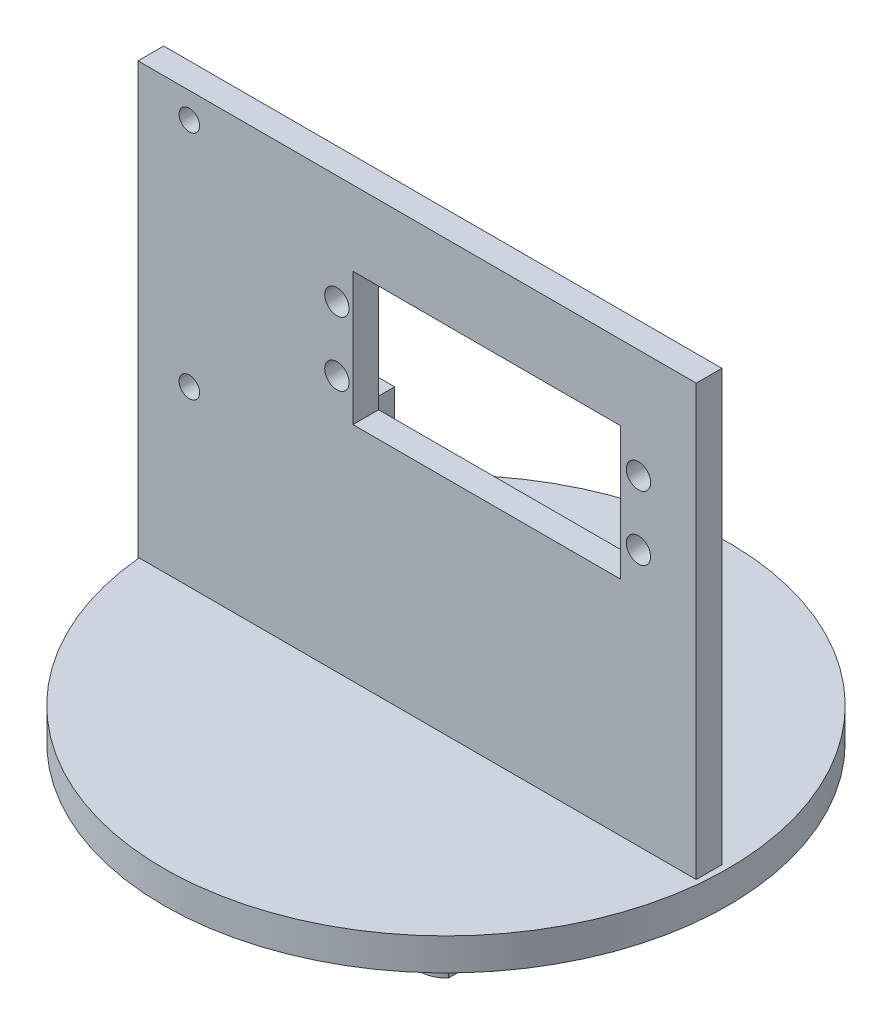
from build123d import *

# Parameters (mm, degrees)
YAW_PLATFORM_START                         = 72
YAW_PLATFORM_PROFILE_R                     = 44
YAW_PLATFORM_DEPTH                         = 5
PRINTED_HOLLOW_YAW_SPINDLE_START           = 43
PRINTED_HOLLOW_YAW_SPINDLE_PROFILE_R       = 3.95
PRINTED_HOLLOW_YAW_SPINDLE_PROFILE_R_2     = 1.75
PRINTED_HOLLOW_YAW_SPINDLE_DEPTH           = 29
INNER_RACE_LOAD_SHOULDER_START             = 70
INNER_RACE_LOAD_SHOULDER_PROFILE_R         = 6
INNER_RACE_LOAD_SHOULDER_PROFILE_R_2       = 1.75
INNER_RACE_LOAD_SHOULDER_DEPTH             = 2
D_FLAT_ON_SPINDLE_END_START                = 43
D_FLAT_DRIVE_KEY_PROFILE_W                 = 3
D_FLAT_DRIVE_KEY_PROFILE_H                 = 10
D_FLAT_ON_SPINDLE_END_DEPTH                = 5
SHOULDER_MOUNT_PLATE_PROFILE_W             = 87
SHOULDER_MOUNT_PLATE_PROFILE_H             = 68
SHOULDER_MOUNT_PLATE_DEPTH                 = 4
MG996_BODY_WINDOW_START                    = -5
MG996_BODY_WINDOW_PROFILE_W                = 41.7
MG996_BODY_WINDOW_PROFILE_H                = 20.7
MG996_BODY_WINDOW_DEPTH                    = 162.869372409
MG996_TAB_MOUNTS_START                     = -50
MG996_TAB_MOUNTS_PROFILE_R                 = 1.9
MG996_TAB_MOUNTS_DEPTH                     = 207.869372409
PASSIVE_SHOULDER_STANDOFFS_START           = -50
PASSIVE_SHOULDER_STANDOFFS_PROFILE_R       = 1.6
PASSIVE_SHOULDER_STANDOFFS_DEPTH           = 207.869372409
UPRIGHT_RIB_START                          = -8
UPRIGHT_RIB_PROFILE_W                      = 7
UPRIGHT_RIB_PROFILE_H                      = 31
UPRIGHT_RIB_DEPTH                          = 12
YAW_POSITIVE_RETENTION_CROSSBOLT_START     = -10
YAW_POSITIVE_RETENTION_CROSSBOLT_PROFILE_R = 1.1
YAW_POSITIVE_RETENTION_CROSSBOLT_DEPTH     = 167.869372409


with BuildPart() as part:
    # Yaw_platform_profile → Yaw_platform (new body)
    with BuildSketch(Plane(origin=(0, 0, 0), x_dir=(1, 0, 0), z_dir=(0, 1, 0)).offset(YAW_PLATFORM_START)):
        with Locations(Location((0, 0, 0), (0, 0, 270))):
            Circle(YAW_PLATFORM_PROFILE_R)
    extrude(amount=YAW_PLATFORM_DEPTH)

    # Printed_hollow_yaw_spindle_profile → Printed_hollow_yaw_spindle (add)
    with BuildSketch(Plane(origin=(0, 0, 0), x_dir=(1, 0, 0), z_dir=(0, 1, 0)).offset(PRINTED_HOLLOW_YAW_SPINDLE_START)):
        with Locations(Location((0, 0, 0), (0, 0, 90))):
            Circle(PRINTED_HOLLOW_YAW_SPINDLE_PROFILE_R)
        with Locations(Location((0, 0, 0), (0, 0, 90))):
            Circle(PRINTED_HOLLOW_YAW_SPINDLE_PROFILE_R_2, mode=Mode.SUBTRACT)
    extrude(amount=PRINTED_HOLLOW_YAW_SPINDLE_DEPTH)

    # Inner_race_load_shoulder_profile → Inner_race_load_shoulder (add)
    with BuildSketch(Plane(origin=(0, 0, 0), x_dir=(1, 0, 0), z_dir=(0, 1, 0)).offset(INNER_RACE_LOAD_SHOULDER_START)):
        with Locations(Location((0, 0, 0), (0, 0, 270))):
            Circle(INNER_RACE_LOAD_SHOULDER_PROFILE_R)
        with Locations(Location((0, 0, 0), (0, 0, 90))):
            Circle(INNER_RACE_LOAD_SHOULDER_PROFILE_R_2, mode=Mode.SUBTRACT)
    extrude(amount=INNER_RACE_LOAD_SHOULDER_DEPTH)

    # D_flat_drive_key_profile → D_flat_on_spindle_end (cut)
    with BuildSketch(Plane(origin=(0, 0, 0), x_dir=(1, 0, 0), z_dir=(0, 1, 0)).offset(D_FLAT_ON_SPINDLE_END_START)):
        with Locations((4.5, 0)):
            Rectangle(D_FLAT_DRIVE_KEY_PROFILE_W, D_FLAT_DRIVE_KEY_PROFILE_H)
    extrude(amount=D_FLAT_ON_SPINDLE_END_DEPTH, mode=Mode.SUBTRACT)

    # Shoulder_mount_plate_profile → Shoulder_mount_plate (add)
    with BuildSketch(Plane.XY):
        with Locations((-0.5, 110)):
            Rectangle(SHOULDER_MOUNT_PLATE_PROFILE_W, SHOULDER_MOUNT_PLATE_PROFILE_H)
    extrude(amount=SHOULDER_MOUNT_PLATE_DEPTH)

    # MG996_body_window_profile → MG996_body_window (cut, through all)
    with BuildSketch(Plane.XY.offset(MG996_BODY_WINDOW_START)):
        with Locations((10.35, 122)):
            Rectangle(MG996_BODY_WINDOW_PROFILE_W, MG996_BODY_WINDOW_PROFILE_H)
    extrude(amount=MG996_BODY_WINDOW_DEPTH, mode=Mode.SUBTRACT)

    # MG996_tab_mounts_profile → MG996_tab_mounts (cut, through all)
    with BuildSketch(Plane.XY.offset(MG996_TAB_MOUNTS_START)):
        with Locations(Location((-13, 117, 0), (0, 0, 180))):
            Circle(MG996_TAB_MOUNTS_PROFILE_R)
        with Locations(Location((-13, 127, 0), (0, 0, 180))):
            Circle(MG996_TAB_MOUNTS_PROFILE_R)
        with Locations(Location((34, 117, 0), (0, 0, 180))):
            Circle(MG996_TAB_MOUNTS_PROFILE_R)
        with Locations(Location((34, 127, 0), (0, 0, 180))):
            Circle(MG996_TAB_MOUNTS_PROFILE_R)
    extrude(amount=MG996_TAB_MOUNTS_DEPTH, mode=Mode.SUBTRACT)

    # Passive_shoulder_standoffs_profile → Passive_shoulder_standoffs (cut, through all)
    with BuildSketch(Plane.XY.offset(PASSIVE_SHOULDER_STANDOFFS_START)):
        with Locations(Location((-36, 104, 0), (0, 0, 180))):
            Circle(PASSIVE_SHOULDER_STANDOFFS_PROFILE_R)
        with Locations(Location((-36, 140, 0), (0, 0, 180))):
            Circle(PASSIVE_SHOULDER_STANDOFFS_PROFILE_R)
    extrude(amount=PASSIVE_SHOULDER_STANDOFFS_DEPTH, mode=Mode.SUBTRACT)

    # Upright_rib_profile → Upright_rib (add)
    with BuildSketch(Plane.XY.offset(UPRIGHT_RIB_START)):
        with Locations((-19.5, 92.5)):
            Rectangle(UPRIGHT_RIB_PROFILE_W, UPRIGHT_RIB_PROFILE_H)
    extrude(amount=UPRIGHT_RIB_DEPTH)

    # Yaw_positive_retention_crossbolt_profile → Yaw_positive_retention_crossbolt (cut, through all)
    with BuildSketch(Plane(origin=(0, 0, 0), x_dir=(0, 0, -1), z_dir=(1, 0, 0)).offset(YAW_POSITIVE_RETENTION_CROSSBOLT_START)):
        with Locations(Location((0, 45.5, 0), (0, 0, 180))):
            Circle(YAW_POSITIVE_RETENTION_CROSSBOLT_PROFILE_R)
    extrude(amount=YAW_POSITIVE_RETENTION_CROSSBOLT_DEPTH, mode=Mode.SUBTRACT)


solid = part.part
